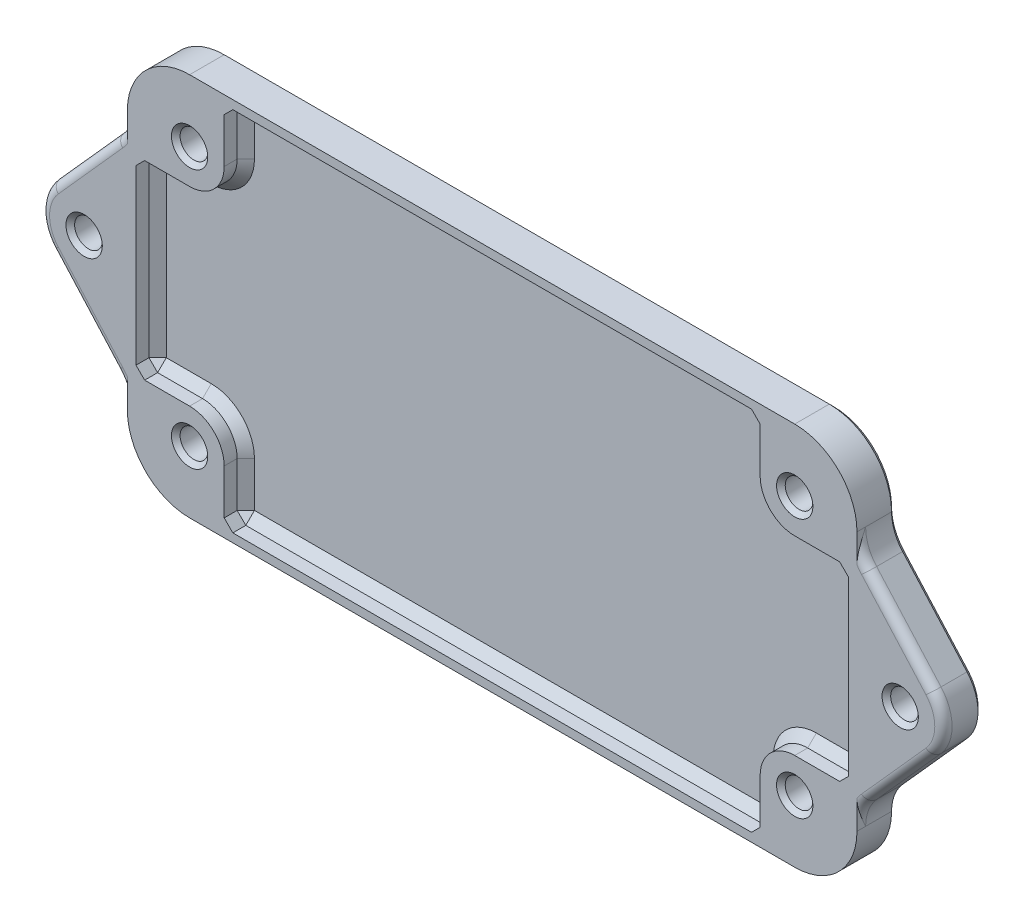
from build123d import *

# Parameters (mm, degrees)
EXTRUDE_1_DEPTH             = 4.5
CUT_EXTRUDE_1_DEPTH         = 2.5
SKETCH_2_3_R                = 1.6
CUT_EXTRUDE_2_DEPTH         = 48.8949893
HOLE_WIZARD_M31_D           = 3.2
HOLE_WIZARD_M31_CSINK_D     = 6.2
HOLE_WIZARD_M31_CSINK_ANGLE = 90
SKETCH_7_R                  = 1.6
EXTRUDE_2_DEPTH             = 4.5
EXTRUDE_2_2_DEPTH           = 4.5
FILLET_1_R                  = 1
FILLET_2_R                  = 1
CHAMFER_1_SIZE              = 0.5
CHAMFER_2_SIZE              = 1


with BuildPart() as part:
    # Эскиз1 → Бобышка-Вытянуть1 (new body)
    with BuildSketch(Plane.XY):
        with BuildLine():
            Line((42.2, -15), (42.2, 15))
            ThreePointArc((42.2, 15), (40.091168825, 20.091168825), (35, 22.2))
            Line((35, 22.2), (-35, 22.2))
            ThreePointArc((-35, 22.2), (-40.091168825, 20.091168825), (-42.2, 15))
            Line((-42.2, 15), (-42.2, -15))
            ThreePointArc((-42.2, -15), (-40.091168825, -20.091168825), (-35, -22.2))
            Line((-35, -22.2), (35, -22.2))
            ThreePointArc((35, -22.2), (40.091168825, -20.091168825), (42.2, -15))
        make_face()
    extrude(amount=EXTRUDE_1_DEPTH)

    # Эскиз2 → Вырез-Вытянуть1 (cut)
    with BuildSketch(Plane.XY.offset(4.5)):
        with BuildLine():
            Line((31, -15), (31, -21.2))
            Line((31, -21.2), (-31, -21.2))
            Line((-31, -21.2), (-31, -15))
            ThreePointArc((-31, -15), (-32.171572875, -12.171572875), (-35, -11))
            Line((-35, -11), (-41.2, -11))
            Line((-41.2, -11), (-41.2, 11))
            Line((-41.2, 11), (-35, 11))
            ThreePointArc((-35, 11), (-32.171572875, 12.171572875), (-31, 15))
            Line((-31, 15), (-31, 21.2))
            Line((-31, 21.2), (31, 21.2))
            Line((31, 21.2), (31, 15))
            ThreePointArc((31, 15), (32.171572875, 12.171572875), (35, 11))
            Line((35, 11), (41.2, 11))
            Line((41.2, 11), (41.2, -11))
            Line((41.2, -11), (35, -11))
            ThreePointArc((35, -11), (32.171572875, -12.171572875), (31, -15))
        make_face()
    extrude(amount=-CUT_EXTRUDE_1_DEPTH, mode=Mode.SUBTRACT)

    # Эскиз2<3> → Вырез-Вытянуть2 (cut, through all)
    with BuildSketch(Plane.XY.offset(4.5)):
        with Locations((35, -15)):
            Circle(SKETCH_2_3_R)
        with Locations((-35, -15)):
            Circle(SKETCH_2_3_R)
        with Locations((-35, 15)):
            Circle(SKETCH_2_3_R)
        with Locations((35, 15)):
            Circle(SKETCH_2_3_R)
    extrude(amount=-CUT_EXTRUDE_2_DEPTH, mode=Mode.SUBTRACT)

    # Зенковка для  винта с потайной головкой с внутренним шестигранником M31 (through all)
    with Locations(Plane(origin=(0, 0, 0), x_dir=(-1, 0, 0), z_dir=(0, 0, -1))):
        with Locations((-35, 15), (-35, -15), (35, -15), (35, 15)):
            CounterSinkHole(HOLE_WIZARD_M31_D / 2, HOLE_WIZARD_M31_CSINK_D / 2, counter_sink_angle=HOLE_WIZARD_M31_CSINK_ANGLE)


with BuildPart() as body_2:
    # Эскиз7 → Бобышка-Вытянуть2 (new body)
    with BuildSketch(Plane.XY):
        with BuildLine():
            Line((43.473220038, -11.666666667), (50.926779962, -3.333333333))
            ThreePointArc((50.926779962, -3.333333333), (52.2, 0), (50.926779962, 3.333333333))
            Line((50.926779962, 3.333333333), (43.473220038, 11.666666667))
            ThreePointArc((43.473220038, 11.666666667), (42.529138205, 13.215889551), (42.2, 15))
            Line((42.2, 15), (42.2, -15))
            ThreePointArc((42.2, -15), (42.529138205, -13.215889551), (43.473220038, -11.666666667))
        make_face()
        with Locations((47.2, 0)):
            Circle(SKETCH_7_R, mode=Mode.SUBTRACT)
    extrude(amount=EXTRUDE_2_DEPTH)

    # Скругление1
    fillet_1_edges = [body_2.edges().sort_by_distance(p)[0] for p in [
        (42.529138205, -13.215889551, 4.5),
        (47.2, -7.5, 4.5),
        (42.529138205, 13.215889551, 4.5),
        (47.2, 7.5, 4.5),
        (52.2, 0, 4.5),
    ]]
    fillet(fillet_1_edges, radius=FILLET_1_R)


with BuildPart() as body_3:
    # Эскиз7 → Extrude 2 2 (new body)
    with BuildSketch(Plane.XY):
        with BuildLine():
            Line((-42.2, -15), (-42.2, 15))
            ThreePointArc((-42.2, 15), (-42.529138205, 13.215889551), (-43.473220038, 11.666666667))
            Line((-43.473220038, 11.666666667), (-50.926779962, 3.333333333))
            ThreePointArc((-50.926779962, 3.333333333), (-52.2, 0), (-50.926779962, -3.333333333))
            Line((-50.926779962, -3.333333333), (-43.473220038, -11.666666667))
            ThreePointArc((-43.473220038, -11.666666667), (-42.529138205, -13.215889551), (-42.2, -15))
        make_face()
        with Locations((-47.2, 0)):
            Circle(SKETCH_7_R, mode=Mode.SUBTRACT)
    extrude(amount=EXTRUDE_2_2_DEPTH)

    # Скругление2
    fillet_2_edges = [body_3.edges().sort_by_distance(p)[0] for p in [
        (-42.529138205, 13.215889551, 4.5),
        (-47.2, 7.5, 4.5),
        (-42.529138205, -13.215889551, 4.5),
        (-47.2, -7.5, 4.5),
        (-52.2, 0, 4.5),
    ]]
    fillet(fillet_2_edges, radius=FILLET_2_R)


with BuildPart() as part_1:
    add(part.part)

    # Combine 1: union body 3, body 2
    add(body_3.part)
    add(body_2.part)

    # Фаска1
    chamfer_1_edges = [part_1.edges().sort_by_distance(p)[0] for p in [
        (0, -22.2, 0),
        (40.091168825, -20.091168825, 0),
        (-40.091168825, -20.091168825, 0),
        (42.529138205, -13.215889551, 0),
        (-42.529138205, -13.215889551, 0),
        (47.2, -7.5, 0),
        (-47.2, -7.5, 0),
        (52.2, 0, 0),
        (-52.2, 0, 0),
        (47.2, 7.5, 0),
        (-47.2, 7.5, 0),
        (42.529138205, 13.215889551, 0),
        (-42.529138205, 13.215889551, 0),
        (40.091168825, 20.091168825, 0),
        (-40.091168825, 20.091168825, 0),
        (0, 22.2, 0),
        (-48.8, 0, 4.5),
        (-36.6, -15, 4.5),
        (-36.6, 15, 4.5),
        (33.4, 15, 4.5),
        (33.4, -15, 4.5),
        (45.6, 0, 4.5),
        (-48.8, 0, 0),
        (45.6, 0, 0),
    ]]
    chamfer(chamfer_1_edges, length=CHAMFER_1_SIZE)

    # Фаска2
    chamfer_2_edges = [part_1.edges().sort_by_distance(p)[0] for p in [
        (-31, -18.1, 2),
        (-38.1, -11, 2),
        (-32.171572875, -12.171572875, 2),
        (-41.2, 0, 2),
        (-38.1, 11, 2),
        (-31, 18.1, 2),
        (-32.171572875, 12.171572875, 2),
        (0, 21.2, 2),
        (38.1, 11, 2),
        (31, 18.1, 2),
        (32.171572875, 12.171572875, 2),
        (41.2, 0, 2),
        (31, -18.1, 2),
        (38.1, -11, 2),
        (32.171572875, -12.171572875, 2),
        (0, -21.2, 2),
        (-41.2, 11, 3.25),
        (-41.2, -11, 3.25),
        (31, 21.2, 3.25),
        (-31, 21.2, 3.25),
        (41.2, 11, 3.25),
        (41.2, -11, 3.25),
        (-31, -21.2, 3.25),
        (31, -21.2, 3.25),
    ]]
    chamfer(chamfer_2_edges, length=CHAMFER_2_SIZE)


solid = part_1.part
